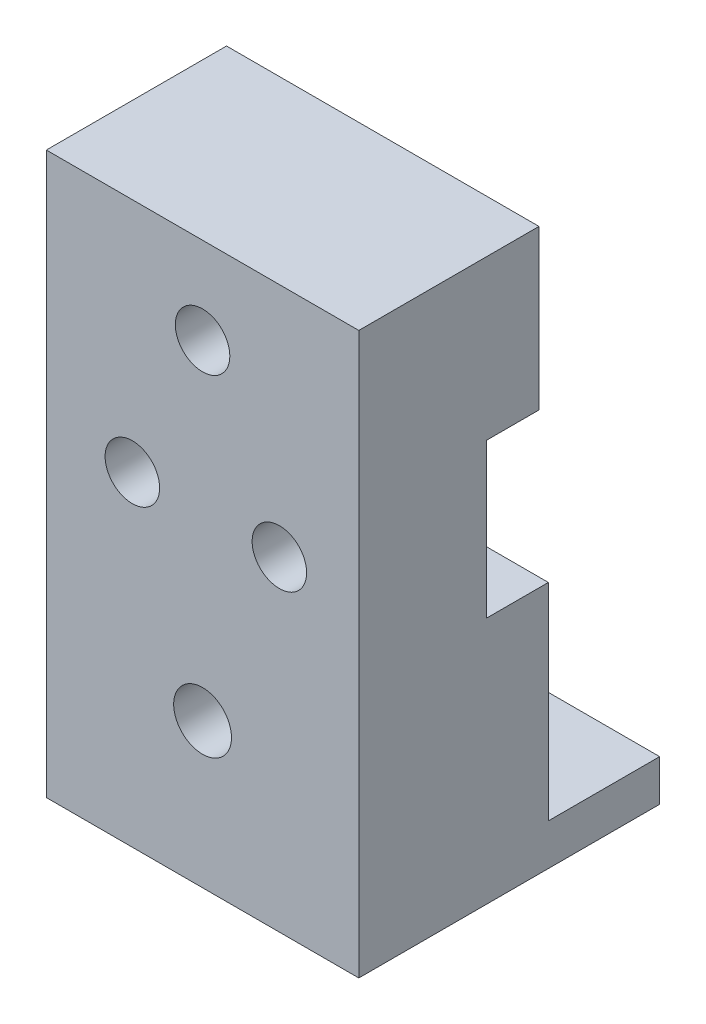
from build123d import *

# Parameters (mm, degrees)
BOSS_EXTRUDE1_DEPTH     = 18.915
CUT_EXTRUDE1_DEPTH      = 73.981798073
CUT_EXTRUDE1_DEPTH_BACK = 73.981798073
SKETCH42_R              = 3.3
SKETCH42_R_2            = 3.5


with BuildPart() as part:
    # Sketch41 → Boss-Extrude1 (new, symmetric)
    with BuildSketch(Plane(origin=(0, 0, 0), x_dir=(0, 0, -1), z_dir=(1, 0, 0))):
        Polygon((4.025167823, -62.9), (17.5, -62.9), (17.5, -67.9), (-18.925, -67.9), (-18.925, 0), (2.88943812, 0), (2.88943812, -19.25), (-3.46056188, -19.25), (-3.46056188, -37.9), (4.025167823, -37.9), align=None)
    extrude(amount=BOSS_EXTRUDE1_DEPTH, both=True)

    # Sketch42 → Cut-Extrude1 (cut, two sides: drawn at the far end of the back side and taken through both)
    with BuildSketch(Plane.XY.offset(-CUT_EXTRUDE1_DEPTH_BACK)):
        with Locations((0, -10.5)):
            Circle(SKETCH42_R)
        with Locations((0, -50.4)):
            Circle(SKETCH42_R_2)
        with Locations((-8.501076983, -28.575)):
            Circle(SKETCH42_R)
        with Locations((9.298923017, -28.575)):
            Circle(SKETCH42_R)
    extrude(amount=CUT_EXTRUDE1_DEPTH + CUT_EXTRUDE1_DEPTH_BACK, mode=Mode.SUBTRACT)


solid = part.part
